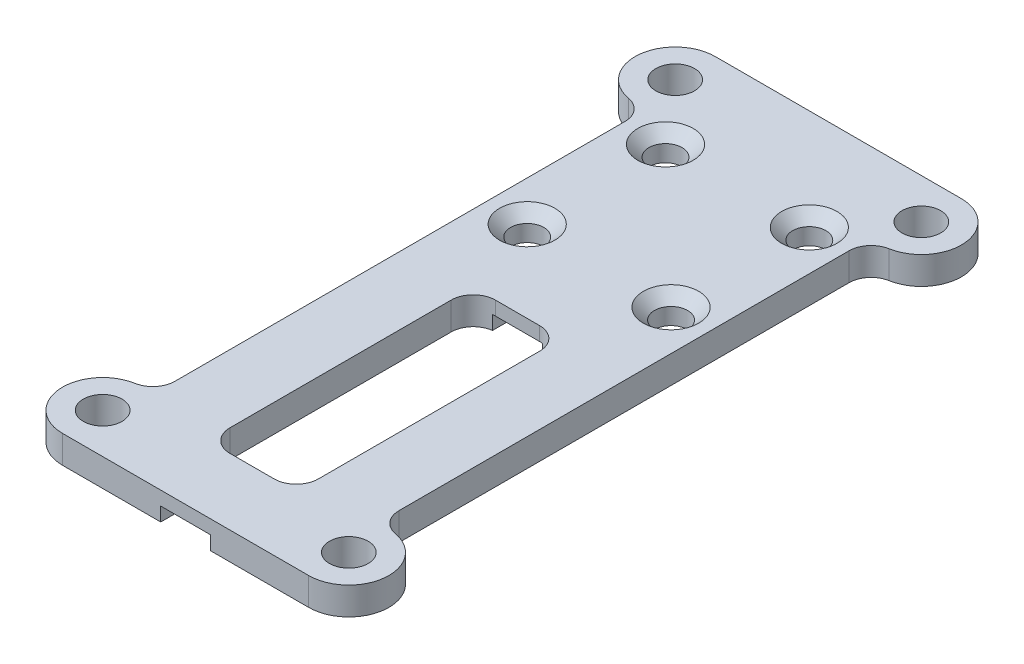
from build123d import *

# Parameters (mm, degrees)
SKETCH1_R           = 1.5
SKETCH1_R_2         = 1.75
BOSS_EXTRUDE1_DEPTH = 2.5
CHAMFER1_SIZE       = 1
CUT_EXTRUDE1_REACH  = 35.077
SKETCH2_W           = 8
SKETCH2_H           = 24
FILLET1_R           = 2
SKETCH3_W           = 4.5
SKETCH3_H           = 59
CUT_EXTRUDE2_DEPTH  = 1.25


with BuildPart() as part:
    # Sketch1 → Boss-Extrude1 (new body)
    with BuildSketch(Plane(origin=(0, 0, 0), x_dir=(1, 0, 0), z_dir=(0, 1, 0))):
        with BuildLine():
            Line((11.125, 29.5), (-11.125, 29.5))
            ThreePointArc((-11.125, 29.5), (-14.714662754, 25.370077916), (-10.125, 22.390660034))
            Line((-10.125, 22.390660034), (-10.125, -22.390660034))
            ThreePointArc((-10.125, -22.390660034), (-14.714662754, -25.370077916), (-11.125, -29.5))
            Line((-11.125, -29.5), (11.125, -29.5))
            ThreePointArc((11.125, -29.5), (14.714662754, -25.370077916), (10.125, -22.390660034))
            Line((10.125, -22.390660034), (10.125, 22.390660034))
            ThreePointArc((10.125, 22.390660034), (14.714662754, 25.370077916), (11.125, 29.5))
        make_face()
        with Locations(Location((-6.5, 7.875, 0), (0, 0, 270))):
            Circle(SKETCH1_R, mode=Mode.SUBTRACT)
        with Locations(Location((6.5, 20.375, 0), (0, 0, 270))):
            Circle(SKETCH1_R, mode=Mode.SUBTRACT)
        with Locations(Location((-6.5, 20.375, 0), (0, 0, 270))):
            Circle(SKETCH1_R, mode=Mode.SUBTRACT)
        with Locations(Location((6.5, 7.875, 0), (0, 0, 270))):
            Circle(SKETCH1_R, mode=Mode.SUBTRACT)
        with Locations(Location((-11.125, 25.875, 0), (0, 0, 270))):
            Circle(SKETCH1_R_2, mode=Mode.SUBTRACT)
        with Locations(Location((11.125, 25.875, 0), (0, 0, 270))):
            Circle(SKETCH1_R_2, mode=Mode.SUBTRACT)
        with Locations(Location((-11.125, -25.875, 0), (0, 0, 270))):
            Circle(SKETCH1_R_2, mode=Mode.SUBTRACT)
        with Locations(Location((11.125, -25.875, 0), (0, 0, 270))):
            Circle(SKETCH1_R_2, mode=Mode.SUBTRACT)
    extrude(amount=BOSS_EXTRUDE1_DEPTH)

    # Chamfer1
    chamfer1_edges = [part.edges().sort_by_distance(p)[0] for p in [
        (6.5, 2.5, -21.875),
        (-6.5, 2.5, -21.875),
        (-6.5, 2.5, -9.375),
        (6.5, 2.5, -9.375),
    ]]
    chamfer(chamfer1_edges, length=CHAMFER1_SIZE)

    # Sketch2 → Cut-Extrude1 (cut, up to next)
    with BuildSketch(Plane(origin=(0, 2.5, 0), x_dir=(1, 0, 0), z_dir=(0, 1, 0)), mode=Mode.PRIVATE) as cut_extrude1_sk1:
        with Locations((0, -11.5)):
            Rectangle(SKETCH2_W, SKETCH2_H)
    cut_extrude1_tool1 = extrude(cut_extrude1_sk1.sketch, amount=-CUT_EXTRUDE1_REACH, mode=Mode.PRIVATE) & part.part
    add(cut_extrude1_tool1.solids().sort_by_distance((0, 2.5, 11.5))[0], mode=Mode.SUBTRACT)

    # Fillet1
    fillet1_edges = [part.edges().sort_by_distance(p)[0] for p in [
        (-10.125, 1.25, 22.390660034),
        (-10.125, 1.25, -22.390660034),
        (10.125, 1.25, -22.390660034),
        (10.125, 1.25, 22.390660034),
        (4, 1.25, -0.5),
        (4, 1.25, 23.5),
        (-4, 1.25, 23.5),
        (-4, 1.25, -0.5),
    ]]
    fillet(fillet1_edges, radius=FILLET1_R)

    # Sketch3 → Cut-Extrude2 (cut)
    with BuildSketch(Plane.XZ):
        Rectangle(SKETCH3_W, SKETCH3_H)
    extrude(amount=-CUT_EXTRUDE2_DEPTH, mode=Mode.SUBTRACT)


solid = part.part
